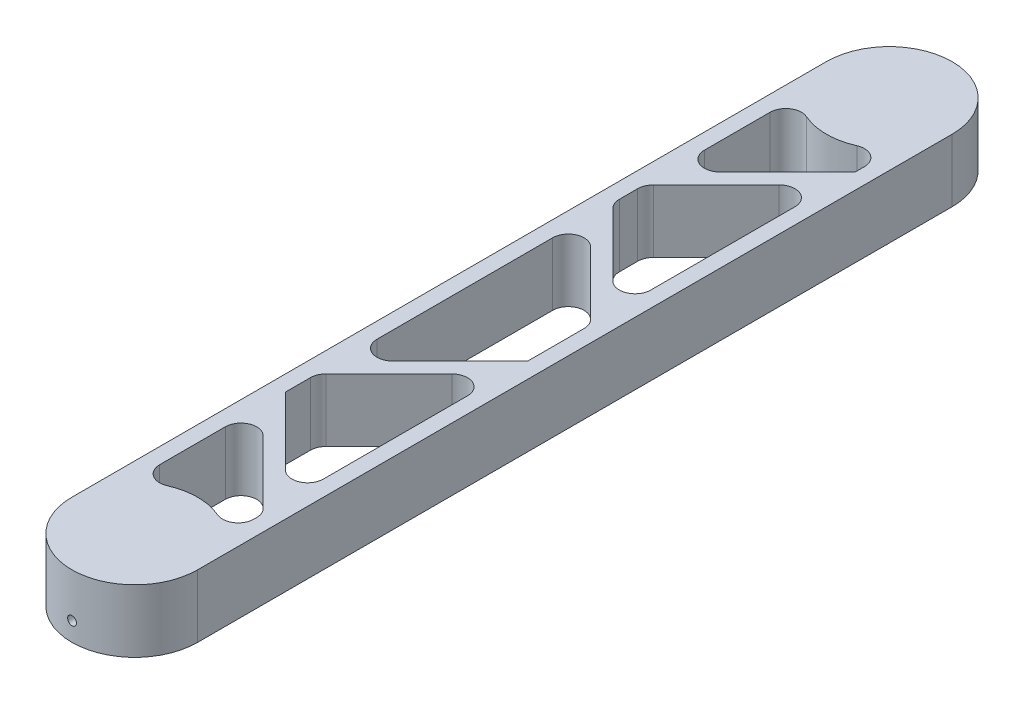
from build123d import *

# Parameters (mm, degrees)
SKETCH1_R           = 12.7
BOSS_EXTRUDE1_DEPTH = 12.7
SKETCH2_R           = 1.6256
CUT_EXTRUDE1_DEPTH  = 9.525
SKETCH3_R           = 9.525
CUT_EXTRUDE2_DEPTH  = 2.54
BOSS_EXTRUDE2_START = -12.7
BOSS_EXTRUDE2_DEPTH = 12.7
SKETCH10_R          = 1.651
CUT_EXTRUDE4_DEPTH  = 9.525
SKETCH11_R          = 9.525
CUT_EXTRUDE5_DEPTH  = 2.54
CUT_EXTRUDE6_DEPTH  = 12.7
FILLET1_R           = 3.175


with BuildPart() as part:
    # Sketch1 → Boss-Extrude1 (new body)
    with BuildSketch(Plane(origin=(0, 0, 0), x_dir=(1, 0, 0), z_dir=(0, 1, 0))):
        with Locations(Location((0, 0, 0), (0, 0, 270))):
            Circle(SKETCH1_R)
    extrude(amount=BOSS_EXTRUDE1_DEPTH)

    # Sketch2 → Cut-Extrude1 (cut)
    with BuildSketch(Plane.XZ):
        with Locations(Location((0, 0, 0), (0, 0, 270))):
            Circle(SKETCH2_R)
    extrude(amount=-CUT_EXTRUDE1_DEPTH, mode=Mode.SUBTRACT)

    # Sketch3 → Cut-Extrude2 (cut)
    with BuildSketch(Plane.XZ):
        with Locations(Location((0, 0, 0), (0, 0, 270))):
            Circle(SKETCH3_R)
    extrude(amount=-CUT_EXTRUDE2_DEPTH, mode=Mode.SUBTRACT)

    # Sketch5 → #2-56 Tapped Hole1 (revolve, cut)
    with BuildSketch(Plane(origin=(0, 3.81, 0), x_dir=(0, 1, 0), z_dir=(1, 0, 0))):
        Polygon((0, 0), (0, 13.74216509), (0.889, 13.208), (0.889, 0), align=None)
    revolve(axis=Axis((0, 3.81, -6.35), (0, 0, 1)), mode=Mode.SUBTRACT)

    # Sketch7 → Boss-Extrude2 (add)
    with BuildSketch(Plane(origin=(0, 12.7, 0), x_dir=(1, 0, 0), z_dir=(0, 1, 0)).offset(BOSS_EXTRUDE2_START)):
        with BuildLine():
            Line((-12.7, 152.4), (-12.7, 0))
            ThreePointArc((-12.7, 0), (0, 12.7), (12.7, 0))
            Line((12.7, 0), (12.7, 152.4))
            ThreePointArc((12.7, 152.4), (0, 165.1), (-12.7, 152.4))
        make_face()
    extrude(amount=BOSS_EXTRUDE2_DEPTH)

    # Sketch10 → Cut-Extrude4 (cut)
    with BuildSketch(Plane.XZ):
        with Locations(Location((0, -152.4, 0), (0, 0, 270))):
            Circle(SKETCH10_R)
    extrude(amount=-CUT_EXTRUDE4_DEPTH, mode=Mode.SUBTRACT)

    # Sketch11 → Cut-Extrude5 (cut)
    with BuildSketch(Plane.XZ):
        with Locations(Location((0, -152.4, 0), (0, 0, 270))):
            Circle(SKETCH11_R)
    extrude(amount=-CUT_EXTRUDE5_DEPTH, mode=Mode.SUBTRACT)

    # Sketch14 → #2-56 Tapped Hole2 (revolve, cut)
    with BuildSketch(Plane(origin=(0, 3.81, -152.4), x_dir=(0, -1, 0), z_dir=(1, 0, 0))):
        Polygon((0, 0), (0, 13.74216509), (0.889, 13.208), (0.889, 0), align=None)
    revolve(axis=Axis((0, 3.81, -146.05), (0, 0, -1)), mode=Mode.SUBTRACT)

    # Sketch15 → Cut-Extrude6 (cut)
    with BuildSketch(Plane.XZ):
        with BuildLine():
            Line((-9.525, -35.469743879), (9.525, -16.419743879))
            Line((9.525, -16.419743879), (9.525, -8.400260413))
            ThreePointArc((9.525, -8.400260413), (0, -12.7), (-9.525, -8.400260413))
            Line((-9.525, -8.400260413), (-9.525, -35.469743879))
        make_face()
        Polygon((-9.525, -46.309871939), (9.525, -65.359871939), (9.525, -20.909871939), (-9.525, -39.959871939), align=None)
        Polygon((-9.525, -76.2), (9.525, -76.2), (9.525, -69.85), (-9.525, -50.8), align=None)
        Polygon((9.525, -82.55), (9.525, -76.2), (-9.525, -76.2), (-9.525, -101.6), align=None)
        Polygon((9.525, -131.490128061), (9.525, -87.040128061), (-9.525, -106.090128061), (-9.525, -112.440128061), align=None)
        with BuildLine():
            Line((9.525, -143.999739587), (9.525, -135.980256121))
            Line((9.525, -135.980256121), (-9.525, -116.930256121))
            Line((-9.525, -116.930256121), (-9.525, -143.999739587))
            ThreePointArc((-9.525, -143.999739587), (0, -139.7), (9.525, -143.999739587))
        make_face()
    extrude(amount=-CUT_EXTRUDE6_DEPTH, mode=Mode.SUBTRACT)

    # Fillet1
    fillet1_edges = [part.edges().sort_by_distance(p)[0] for p in [
        (9.525, 6.35, -143.999739587),
        (-9.525, 6.35, -143.999739587),
        (-9.525, 6.35, -116.930256121),
        (-9.525, 6.35, -35.469743879),
        (9.525, 6.35, -16.419743879),
        (9.525, 6.35, -8.400260413),
        (-9.525, 6.35, -8.400260413),
        (-9.525, 6.35, -46.309871939),
        (9.525, 6.35, -65.359871939),
        (9.525, 6.35, -20.909871939),
        (-9.525, 6.35, -101.6),
        (-9.525, 6.35, -50.8),
        (9.525, 6.35, -82.55),
        (9.525, 6.35, -131.490128061),
        (9.525, 6.35, -87.040128061),
        (-9.525, 6.35, -106.090128061),
        (-9.525, 6.35, -112.440128061),
    ]]
    fillet(fillet1_edges, radius=FILLET1_R)


solid = part.part
